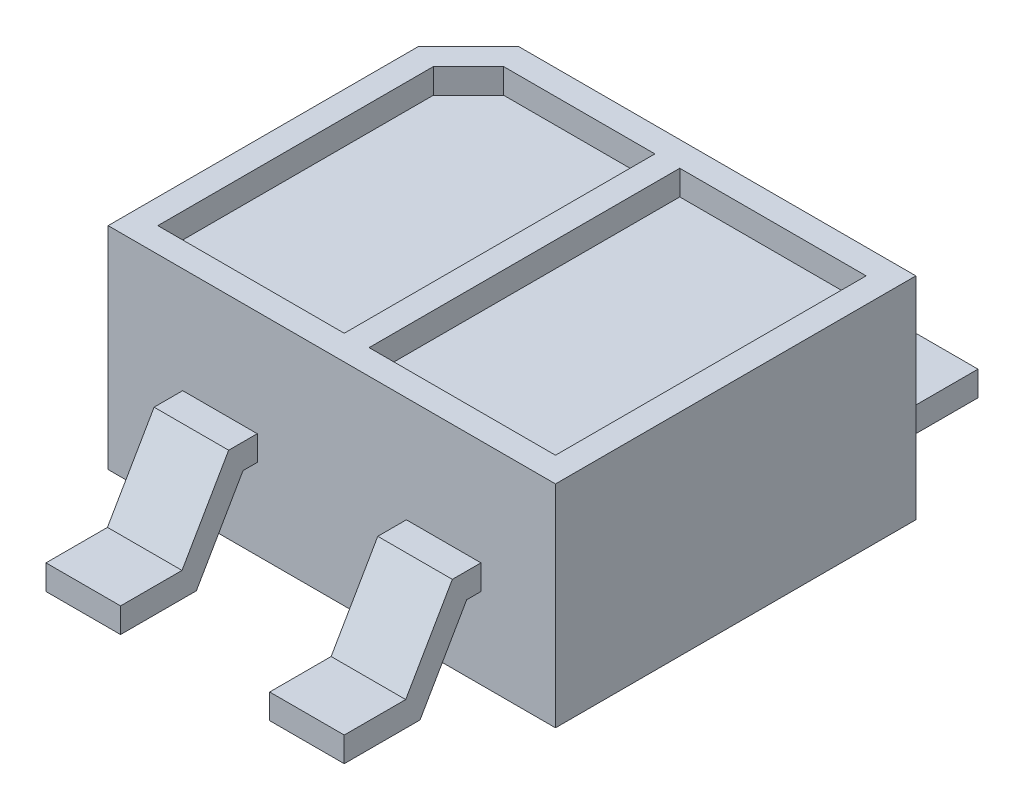
from build123d import *

# Parameters (mm, degrees)
BASE_DEPTH           = 1.7
SKETCH2_W            = 1.5
SKETCH2_H            = 2.5
SENSOR_INDENTS_DEPTH = 0.2
FOOT_DEPTH           = 0.3
FEET_COUNT           = 2
FEET_PITCH           = 1.8
FEETS_COPY_1_DEPTH   = 0.3


with BuildPart() as part:
    # Sketch1 → Base (new body)
    with BuildSketch(Plane(origin=(0, 0, 0), x_dir=(1, 0, 0), z_dir=(0, 1, 0))):
        Polygon((-3.2, 2.9), (-3.6, 2.5), (-3.6, 0), (0, 0), (0, 2.9), align=None)
    extrude(amount=BASE_DEPTH)

    # Sketch2 → Sensor Indents (cut)
    with BuildSketch(Plane(origin=(0, 1.7, 0), x_dir=(1, 0, 0), z_dir=(0, 1, 0))):
        with Locations((-0.95, 1.45)):
            Rectangle(SKETCH2_W, SKETCH2_H)
        Polygon((-1.9, 0.2), (-1.9, 2.7), (-3.117157288, 2.7), (-3.4, 2.417157288), (-3.4, 0.2), align=None)
    extrude(amount=-SENSOR_INDENTS_DEPTH, mode=Mode.SUBTRACT)

    # Sketch3 → Foot (add, symmetric)
    with BuildSketch(Plane(origin=(-0.9, 0, 0), x_dir=(0, 0, -1), z_dir=(1, 0, 0))):
        Polygon((-1.1, 0), (-0.49, 0), (-0.114722325, 0.65), (0, 0.65), (0, 0.85), (-0.230192379, 0.85), (-0.605470054, 0.2), (-1.1, 0.2), align=None)
    foot = extrude(amount=FOOT_DEPTH, both=True)

    # Feet: Foot ×2
    with Locations(*[(-i * FEET_PITCH, 0, 0) for i in range(1, FEET_COUNT)]):
        add(foot)

    # Feets: Foot across plane
    add(foot.mirror(Plane.XY.offset(-1.45)))

    # Feets copy 1 sketch → Feets copy 1 (add, symmetric)
    with BuildSketch(Plane(origin=(-2.7, 0, -2.9), x_dir=(0, 0, 1), z_dir=(1, 0, 0))):
        Polygon((-1.1, 0), (-0.49, 0), (-0.114722325, -0.65), (0, -0.65), (0, -0.85), (-0.230192379, -0.85), (-0.605470054, -0.2), (-1.1, -0.2), align=None)
    extrude(amount=FEETS_COPY_1_DEPTH, both=True)


solid = part.part
